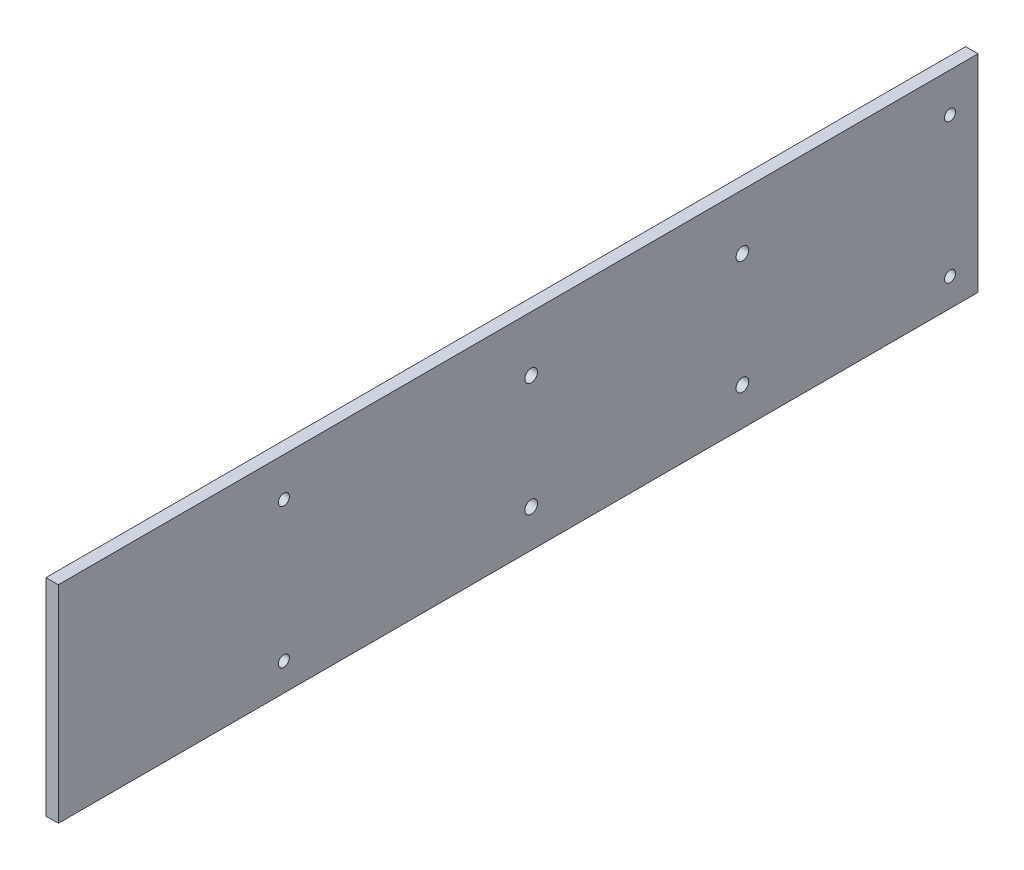
from build123d import *

# Parameters (mm, degrees)
SKETCH1_W                 = 359.41
SKETCH1_H                 = 76.2
BOSS_EXTRUDE1_DEPTH       = 4.826
F_10_CLEARANCE_HOLE1_D    = 4.9784
F_8_CLEARANCE_HOLE1_D     = 4.3053
F_8_CLEARANCE_HOLE1_DEPTH = 12.7
F_8_CLEARANCE_HOLE1_TIP   = 1.293442612
SKETCH31_W                = 4.826
SKETCH31_H                = 359.41
BOSS_EXTRUDE10_DEPTH      = 4.572


with BuildPart() as part:
    # Sketch1 → Boss-Extrude1 (new body)
    with BuildSketch(Plane(origin=(0, 0, 0), x_dir=(0, 0, -1), z_dir=(1, 0, 0))):
        Rectangle(SKETCH1_W, SKETCH1_H)
    extrude(amount=BOSS_EXTRUDE1_DEPTH)

    # #10 Clearance Hole1 (through all)
    with Locations(Plane(origin=(4.826, 0, 0), x_dir=(0, 0, -1), z_dir=(1, 0, 0))):
        with Locations((87.63, -27.94), (5.08, -27.94), (5.08, 16.51), (87.63, 16.51)):
            Hole(F_10_CLEARANCE_HOLE1_D / 2)

    # #8 Clearance Hole1
    with Locations(Plane(origin=(4.826, 0, 0), x_dir=(0, 0, -1), z_dir=(1, 0, 0))):
        with Locations((-91.567, 22.86), (-91.567, -31.75), (168.783, -31.75), (168.783, 22.86)):
            Hole(F_8_CLEARANCE_HOLE1_D / 2, depth=F_8_CLEARANCE_HOLE1_DEPTH)
            with Locations((0, 0, -(F_8_CLEARANCE_HOLE1_DEPTH + F_8_CLEARANCE_HOLE1_TIP / 2))):  # 118° drill point
                Cone(0, F_8_CLEARANCE_HOLE1_D / 2, F_8_CLEARANCE_HOLE1_TIP, mode=Mode.SUBTRACT)

    # Sketch31 → Boss-Extrude10 (add)
    with BuildSketch(Plane.XZ.offset(38.1)):
        with Locations((2.413, 0)):
            Rectangle(SKETCH31_W, SKETCH31_H)
    extrude(amount=BOSS_EXTRUDE10_DEPTH)


solid = part.part
